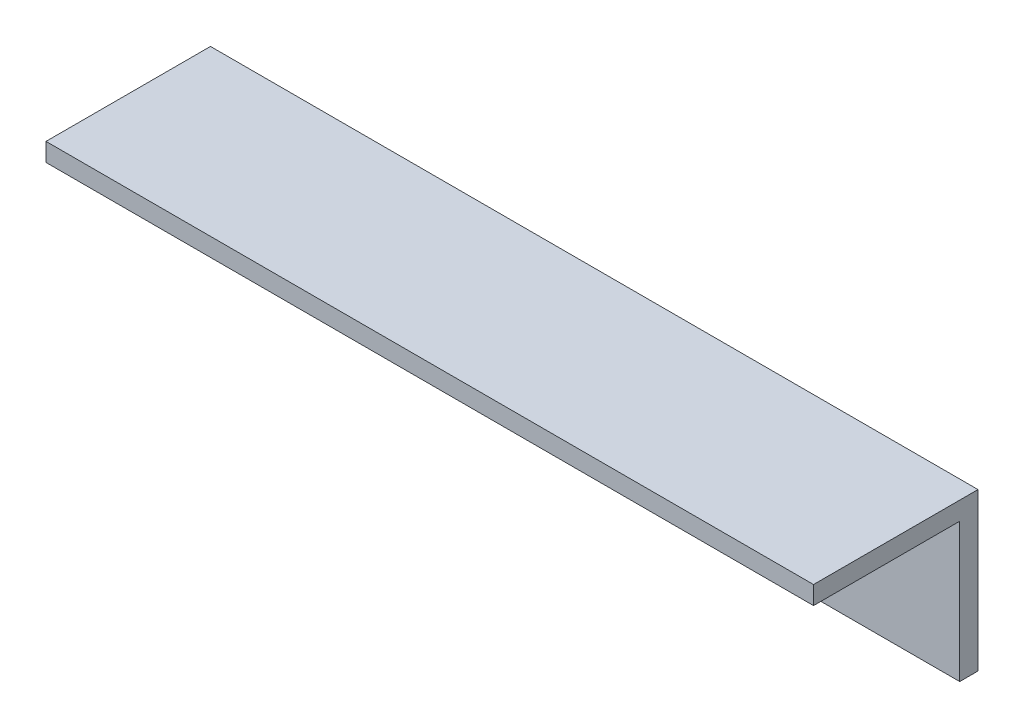
from build123d import *

# Parameters (mm, degrees)
SKETCH1_R           = 3.57124
BOSS_EXTRUDE1_DEPTH = 3.175
SKETCH2_W           = 133.35
SKETCH2_H           = 3.175
BOSS_EXTRUDE2_DEPTH = 25.4


with BuildPart() as part:
    # Sketch1 → Boss-Extrude1 (new body)
    with BuildSketch(Plane.XY):
        Polygon((-66.675, 162.56), (-66.675, 138.43), (66.675, 138.43), (66.675, 162.56), (66.675, 165.735), (-66.675, 165.735), align=None)
        with Locations((51.435, 153.67)):
            Circle(SKETCH1_R, mode=Mode.SUBTRACT)
        with Locations((-51.435, 153.67)):
            Circle(SKETCH1_R, mode=Mode.SUBTRACT)
    extrude(amount=BOSS_EXTRUDE1_DEPTH)

    # Sketch2 → Boss-Extrude2 (add)
    with BuildSketch(Plane.XY.offset(3.175)):
        with Locations((0, 164.1475)):
            Rectangle(SKETCH2_W, SKETCH2_H)
    extrude(amount=BOSS_EXTRUDE2_DEPTH)


solid = part.part
